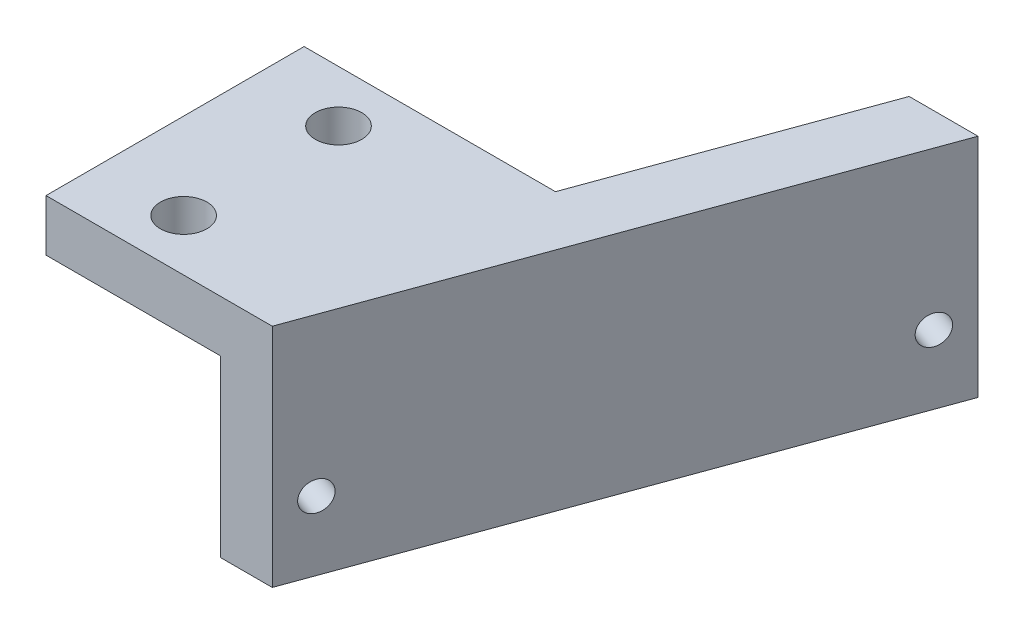
from build123d import *

# Parameters (mm, degrees)
BOSS_EXTRUDE1_DEPTH = 30
BOSS_EXTRUDE2_DEPTH = 26.3
BOSS_EXTRUDE3_DEPTH = 26.3
CUT_EXTRUDE1_REACH  = 58.563
SKETCH4_R           = 1.7
CUT_EXTRUDE2_START  = -6
SKETCH5_R           = 2.95
CUT_EXTRUDE2_DEPTH  = 21
SKETCH7_R           = 2.7
CUT_EXTRUDE3_DEPTH  = 21


with BuildPart() as part:
    # Sketch1 → Boss-Extrude1 (new body)
    with BuildSketch(Plane.XY):
        Polygon((0, 0), (0, 20.3), (-20.3, 20.3), (-20.3, 26.3), (6, 26.3), (6, 0), align=None)
    extrude(amount=BOSS_EXTRUDE1_DEPTH)

    # Sketch2 → Boss-Extrude2 (add)
    with BuildSketch(Plane.XZ):
        Polygon((6, 0), (16.919107028, 0), (6, 30), align=None)
    extrude(amount=-BOSS_EXTRUDE2_DEPTH)

    # Sketch3 → Boss-Extrude3 (add)
    with BuildSketch(Plane(origin=(0, 26.3, 0), x_dir=(1, 0, 0), z_dir=(0, 1, 0))):
        Polygon((16.919107028, 0), (27.889289173, 30.14032773), (19.889289173, 30.14032773), (8.919107028, 0), align=None)
    extrude(amount=-BOSS_EXTRUDE3_DEPTH)

    # Cut-Extrude1: up to this plane
    cut_extrude1_end = Plane(origin=(0, 0, 30), z_dir=(1, 0, 0))
    # Sketch4 → Cut-Extrude1 (cut, up to the surface)
    with BuildSketch(Plane(origin=(14.939947475, 0, 5.437696182), x_dir=(0.34202014332567265, 0, -0.9396926207859071), z_dir=(0.9396926207859071, 0, 0.34202014332567265)), mode=Mode.PRIVATE) as cut_extrude1_sk1:
        with Locations((-22.138657764, 8)):
            Circle(SKETCH4_R)
    cut_extrude1_tool1 = split(extrude(cut_extrude1_sk1.sketch, amount=-CUT_EXTRUDE1_REACH, mode=Mode.PRIVATE), bisect_by=cut_extrude1_end, keep=Keep.BOTH, mode=Mode.PRIVATE)
    add(cut_extrude1_tool1.solids().sort_by_distance((7.368081, 8, 26.24123))[0], mode=Mode.SUBTRACT)
    # Sketch4 → Cut-Extrude1 (cut, up to the surface)
    with BuildSketch(Plane(origin=(14.939947475, 0, 5.437696182), x_dir=(0.34202014332567265, 0, -0.9396926207859071), z_dir=(0.9396926207859071, 0, 0.34202014332567265)), mode=Mode.PRIVATE) as cut_extrude1_sk2:
        with Locations(Location((33.861342236, 8, 0), (0, 0, 41.975179766))):
            Circle(SKETCH4_R)
    cut_extrude1_tool2 = split(extrude(cut_extrude1_sk2.sketch, amount=-CUT_EXTRUDE1_REACH, mode=Mode.PRIVATE), bisect_by=cut_extrude1_end, keep=Keep.BOTH, mode=Mode.PRIVATE)
    add(cut_extrude1_tool2.solids().sort_by_distance((26.521209, 8, -26.381557))[0], mode=Mode.SUBTRACT)

    # Sketch5 → Cut-Extrude2 (cut)
    with BuildSketch(Plane(origin=(14.939947475, 0, 5.437696182), x_dir=(0.34202014332567265, 0, -0.9396926207859071), z_dir=(0.9396926207859071, 0, 0.34202014332567265)).offset(CUT_EXTRUDE2_START)):
        with Locations((-22.138657764, 8)):
            Circle(SKETCH5_R)
        with Locations((33.861342236, 8)):
            Circle(SKETCH5_R)
    extrude(amount=-CUT_EXTRUDE2_DEPTH, mode=Mode.SUBTRACT)

    # Sketch7 → Cut-Extrude3 (cut)
    with BuildSketch(Plane(origin=(0, 26.3, 0), x_dir=(1, 0, 0), z_dir=(0, 1, 0))):
        with Locations(Location((-10.3, -24, 0), (0, 0, 180))):
            Circle(SKETCH7_R)
        with Locations(Location((-10.3, -6, 0), (0, 0, 180))):
            Circle(SKETCH7_R)
    extrude(amount=-CUT_EXTRUDE3_DEPTH, mode=Mode.SUBTRACT)


solid = part.part
